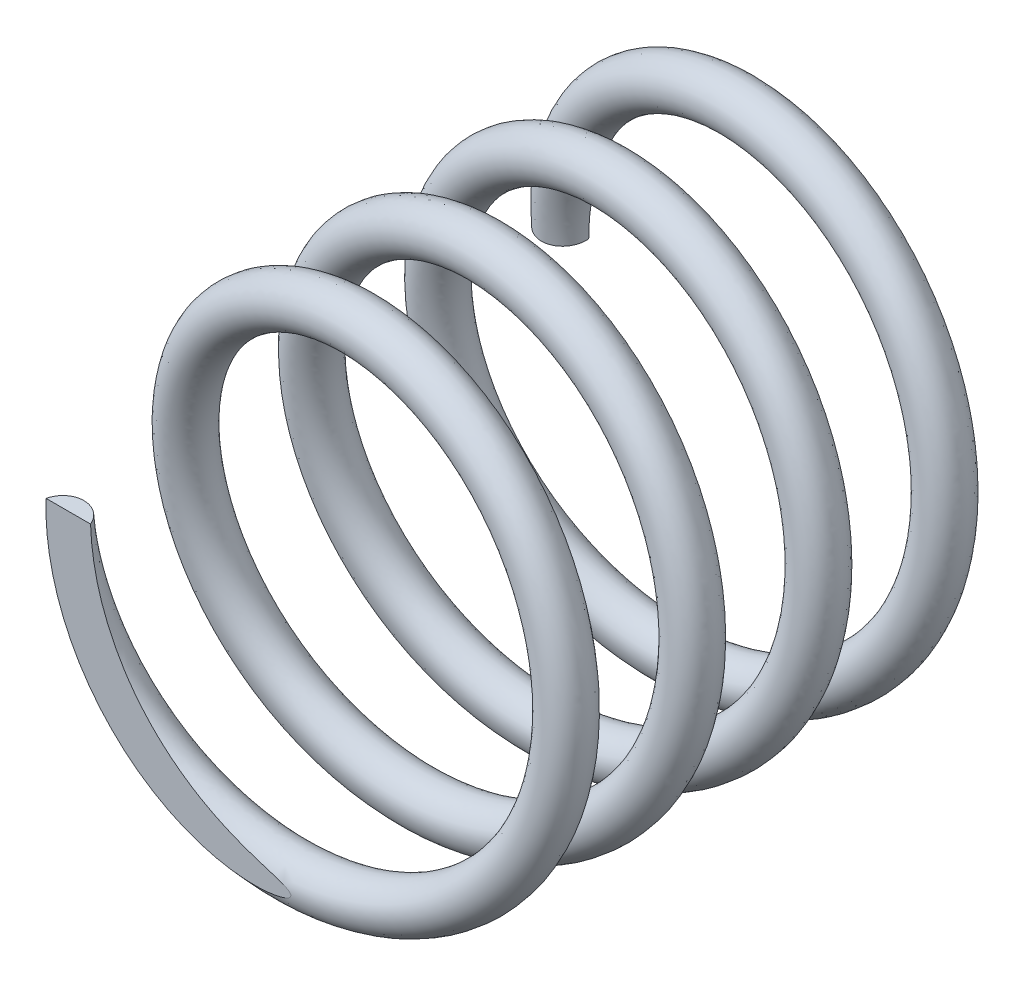
from build123d import *

# Parameters (mm, degrees)
SWEEP1_PITCH       = 25.4
SWEEP1_HEIGHT      = 101.6
SWEEP1_RADIUS      = 44.45
SWEEP1_START_ANGLE = -180
SKETCH2_R          = 4.7625


with BuildPart() as part:
    # Sweep1: sweep along a helix
    with BuildLine() as sweep1_path:
        add(Helix(SWEEP1_PITCH, SWEEP1_HEIGHT, SWEEP1_RADIUS, center=(0, 0, 0), direction=(0, 0, 1), lefthand=True, mode=Mode.PRIVATE).rotate(Axis((0, 0, 0), (0, 0, 1)), SWEEP1_START_ANGLE))
    # Sketch2 → Sweep1 (sweep)
    with BuildSketch(Plane(origin=(-44.45, 0, 101.6), x_dir=(-0.7602145395913772, -0.05884202965445457, 0.6470019082970426), z_dir=(4.831551825290603e-14, 0.9958899201960775, 0.09057188775691061))):
        Circle(SKETCH2_R)
    sweep(path=sweep1_path.line, is_frenet=True)

    # SurfaceCut1
    split(bisect_by=Plane.XY, keep=Keep.TOP)

    # SurfaceCut3
    split(bisect_by=Plane.XY.offset(99.999999898), keep=Keep.BOTTOM)


solid = part.part
